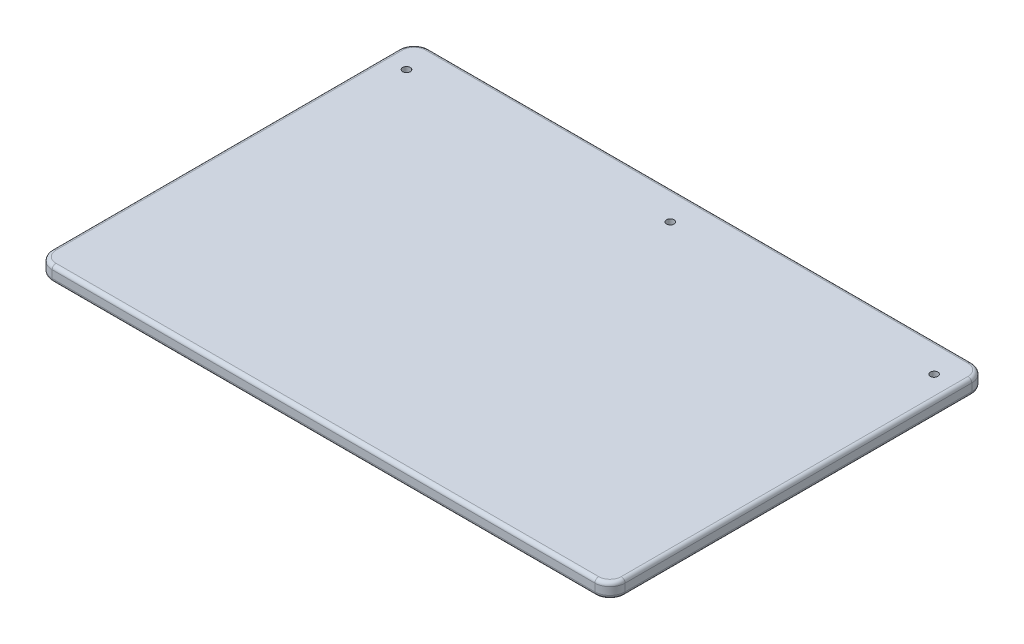
from build123d import *
from OCP.BRepFilletAPI import BRepFilletAPI_MakeFillet

# Parameters (mm, degrees)
SKETCH1_W           = 380
SKETCH1_H           = 250
BOSS_EXTRUDE1_DEPTH = 10
FILLET1_R1          = 10
FILLET1_R2          = 2.5
SKETCH2_R           = 2.5
CUT_EXTRUDE1_DEPTH  = 228.651048895


with BuildPart() as part:
    # Sketch1 → Boss-Extrude1 (new body)
    with BuildSketch(Plane(origin=(0, 0, 0), x_dir=(1, 0, 0), z_dir=(0, 1, 0))):
        Rectangle(SKETCH1_W, SKETCH1_H)
    extrude(amount=BOSS_EXTRUDE1_DEPTH)

    # Fillet1: one fillet with a radius per group of edges: ONE call of the kernel's fillet builder (fillet() takes one radius for all edges)
    fillet1_edges_1 = [part.edges().sort_by_distance(p)[0] for p in [
        (190, 5, 125),
        (-190, 5, 125),
        (-190, 5, -125),
        (190, 5, -125),
    ]]
    fillet1_edges_2 = [part.edges().sort_by_distance(p)[0] for p in [
        (190, 10, 0),
        (190, 0, 0),
        (0, 10, -125),
        (0, 0, -125),
        (-190, 10, 0),
        (-190, 0, 0),
        (0, 10, 125),
        (0, 0, 125),
    ]]
    fillet1 = BRepFilletAPI_MakeFillet(part.part.solid().wrapped)
    for e in fillet1_edges_1:
        fillet1.Add(FILLET1_R1, e.wrapped)
    for e in fillet1_edges_2:
        fillet1.Add(FILLET1_R2, e.wrapped)
    add(Compound.cast(fillet1.Shape()), mode=Mode.REPLACE)

    # Sketch2 → Cut-Extrude1 (cut, through all)
    with BuildSketch(Plane.XZ):
        with Locations((0, -105)):
            Circle(SKETCH2_R)
        with Locations((-175, -105)):
            Circle(SKETCH2_R)
        with Locations((175, -105)):
            Circle(SKETCH2_R)
    extrude(amount=-CUT_EXTRUDE1_DEPTH, mode=Mode.SUBTRACT)


solid = part.part
